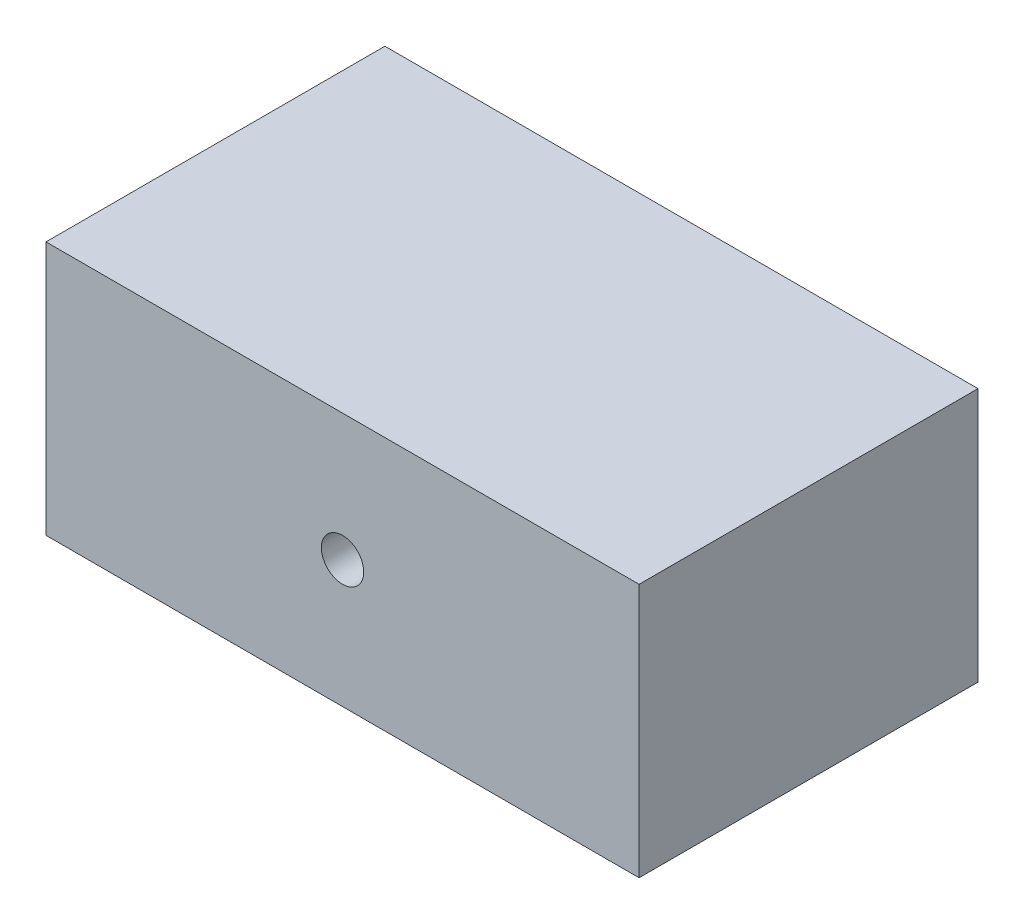
from build123d import *

# Parameters (mm, degrees)
SKETCH1_W           = 88.9
SKETCH1_H           = 38.1
SKETCH1_R           = 3.175
BOSS_EXTRUDE1_DEPTH = 50.8


with BuildPart() as part:
    # Sketch1 → Boss-Extrude1 (new body)
    with BuildSketch(Plane.XY):
        with Locations((44.45, 19.05)):
            Rectangle(SKETCH1_W, SKETCH1_H)
        with Locations((44.45, 19.05)):
            Circle(SKETCH1_R, mode=Mode.SUBTRACT)
    extrude(amount=BOSS_EXTRUDE1_DEPTH)


solid = part.part
